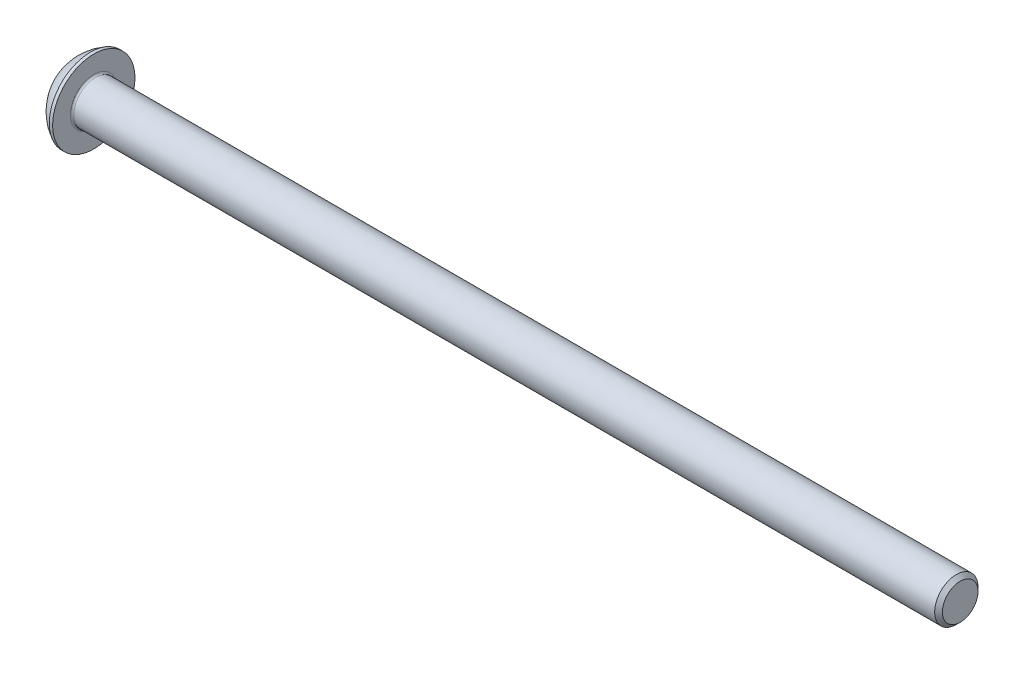
from build123d import *

# Parameters (mm, degrees)
FILLET1_R   = 0.2
HEX_2_DEPTH = 1.56


with BuildPart() as part:
    # BodySke → BaseBody (revolve)
    with BuildSketch(Plane.XY, mode=Mode.PRIVATE) as basebody_sk:
        with BuildLine():
            Line((102.75, 0), (102.75, 2.055))
            Line((102.75, 2.055), (102.305, 2.5))
            Line((102.305, 2.5), (2.75, 2.5))
            Line((2.75, 2.5), (2.75, 4.75))
            Line((2.75, 4.75), (2.37, 4.75))
            ThreePointArc((2.37, 4.75), (0.992680215, 3.754414901), (0, 2.375))
            Line((0, 2.375), (0, 0))
            Line((0, 0), (102.75, 0))
        make_face()
    revolve(basebody_sk.sketch.rotate(Axis((0, 0, 0), (1, 0, 0)), 90), axis=Axis((0, 0, 0), (1, 0, 0)))

    # Fillet1
    fillet1_edges = [part.edges().sort_by_distance(p)[0] for p in [
        (2.75, 0, -2.5),
    ]]
    fillet(fillet1_edges, radius=FILLET1_R)

    # Sketch2 → PreBroach (revolve, cut)
    with BuildSketch(Plane.XY, mode=Mode.PRIVATE) as prebroach_sk:
        Polygon((0, 1.5), (1.56, 1.5), (2.426025404, 0), (0, 0), align=None)
    revolve(prebroach_sk.sketch.rotate(Axis((0, 0, 0), (1, 0, 0)), 90), axis=Axis((0, 0, 0), (1, 0, 0)), mode=Mode.SUBTRACT)

    # Sketch3 → Hex 2 (cut)
    with BuildSketch(Plane(origin=(0, 0, 0), x_dir=(0, 0, -1), z_dir=(1, 0, 0))):
        Polygon((-1.5, -0.866025404), (-1.5, 0.866025404), (0, 1.732050808), (1.5, 0.866025404), (1.5, -0.866025404), (0, -1.732050808), align=None)
    extrude(amount=HEX_2_DEPTH, mode=Mode.SUBTRACT)


solid = part.part
